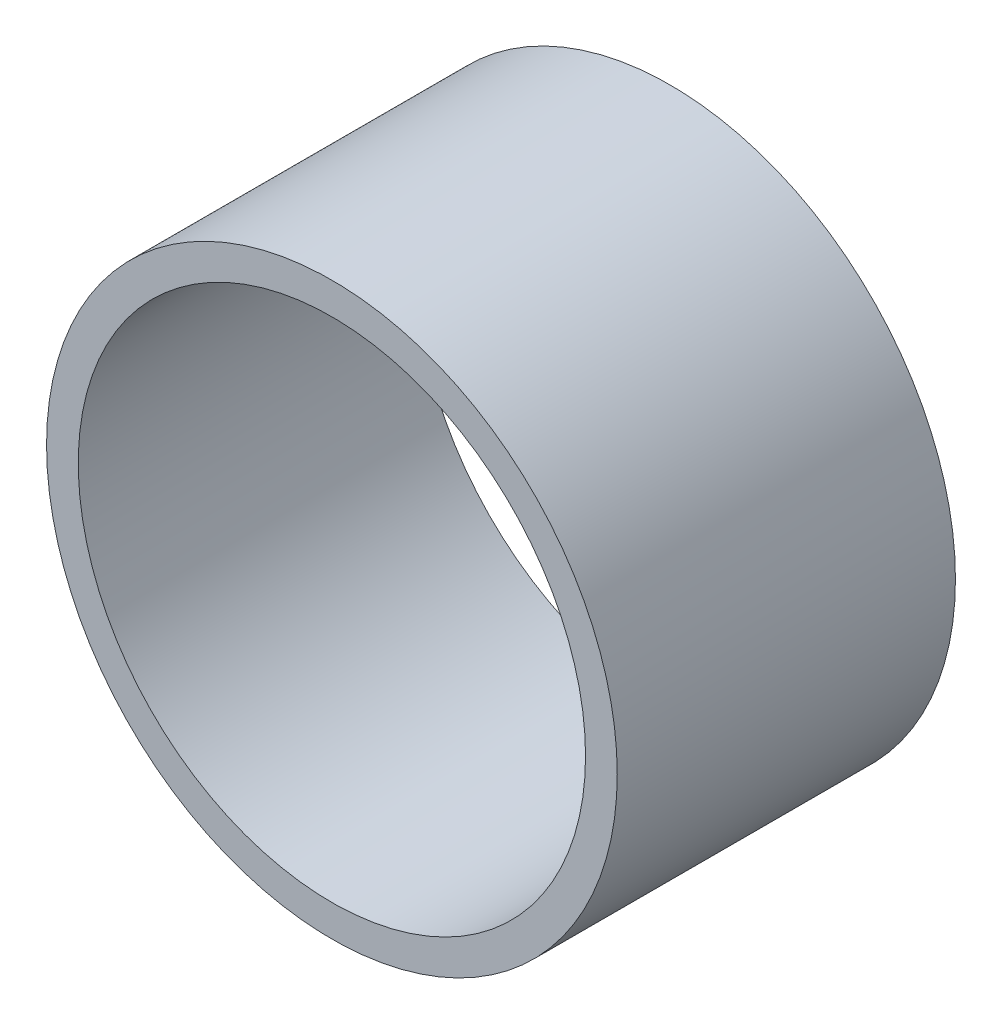
from build123d import *

# Parameters (mm, degrees)
SKETCH2_R           = 67.5
BOSS_EXTRUDE1_DEPTH = 40
SKETCH3_R           = 60
CUT_EXTRUDE1_DEPTH  = 125.549187071


with BuildPart() as part:
    # Sketch2 → Boss-Extrude1 (new, symmetric)
    with BuildSketch(Plane.XY):
        Circle(SKETCH2_R)
    extrude(amount=BOSS_EXTRUDE1_DEPTH, both=True)

    # Sketch3 → Cut-Extrude1 (cut, through all)
    with BuildSketch(Plane.XY.offset(40)):
        Circle(SKETCH3_R)
    extrude(amount=-CUT_EXTRUDE1_DEPTH, mode=Mode.SUBTRACT)


solid = part.part
